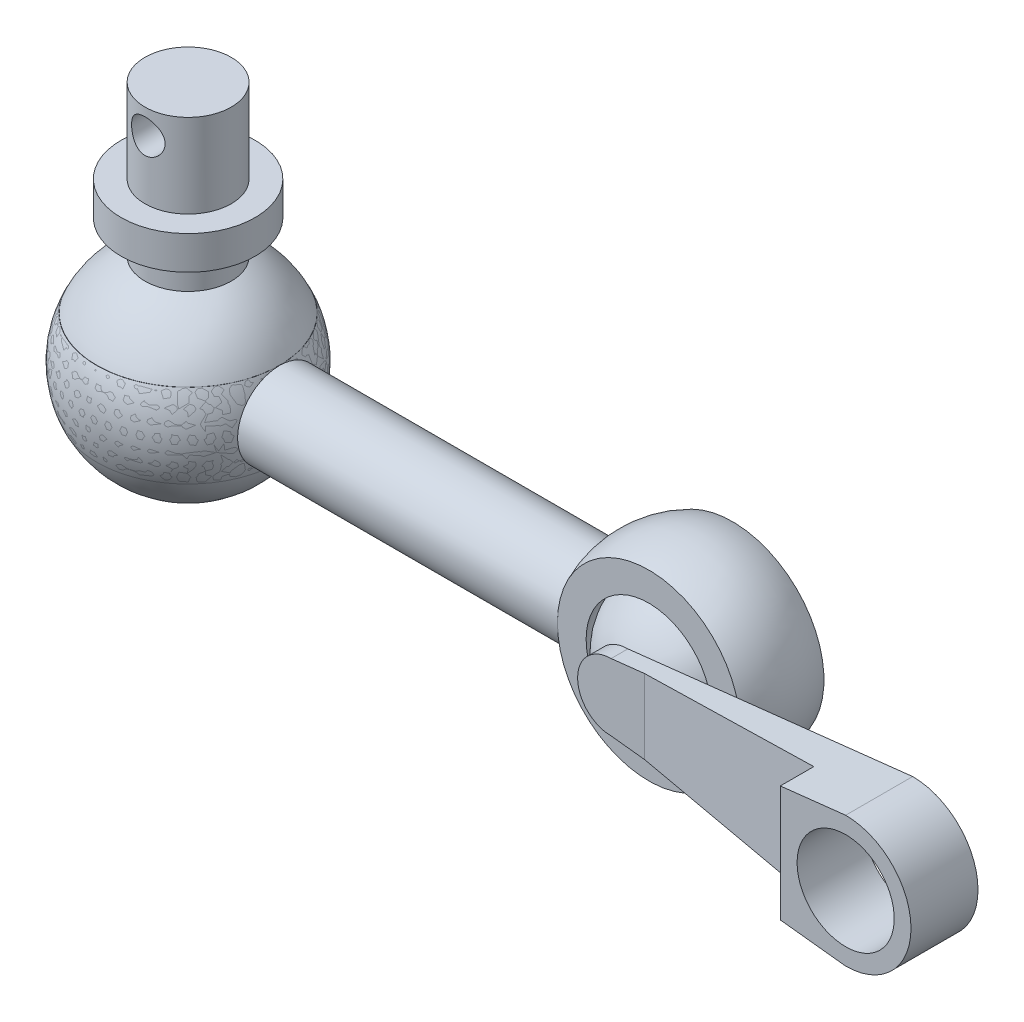
from build123d import *
from build123d.topology import SkipClean

# Parameters (mm, degrees)
BOSS_EXTRUDE1_START     = -4.545644
SKETCH4_R               = 2.5
BOSS_EXTRUDE1_DEPTH     = 19.091288
CUT_EXTRUDE1_DEPTH      = 28.349588662
CUT_EXTRUDE1_DEPTH_BACK = 28.349588662
SKETCH5_W               = 10.908712114
SKETCH5_H               = 5.248275299
CUT_EXTRUDE2_DEPTH      = 28.349588662
CUT_EXTRUDE2_DEPTH_BACK = 28.349588662
SKETCH6_W               = 10.908712114
SKETCH6_H               = 5.959766694
BOSS_EXTRUDE2_START     = 8.75
SKETCH11_R              = 2
BOSS_EXTRUDE2_DEPTH     = 5
BOSS_EXTRUDE3_START     = 14.419352
SKETCH13_R              = 2.575
BOSS_EXTRUDE3_DEPTH     = 9
BOSS_EXTRUDE6_START     = -5
BOSS_EXTRUDE6_DEPTH     = 4
CUT_EXTRUDE3_DEPTH      = 45.241272722
CUT_EXTRUDE3_DEPTH_BACK = 45.241272722
CUT_EXTRUDE4_DEPTH      = 45.449861778
CUT_EXTRUDE4_DEPTH_BACK = 45.449861778
SKETCH19_R              = 2.9
BOSS_EXTRUDE7_START     = -5
SKETCH20_R              = 4
BOSS_EXTRUDE7_DEPTH     = 2
CUT_EXTRUDE6_DEPTH      = 45.054400599
CUT_EXTRUDE6_DEPTH_BACK = 45.054400599
SKETCH21_R              = 1


with BuildPart() as part:
    # Sketch2 → Revolve1 (revolve)
    with BuildSketch(Plane(origin=(0, 0, 0), x_dir=(1, 0, 0), z_dir=(0, 1, 0))):
        with BuildLine():
            Line((20, 6), (20, 4.5))
            ThreePointArc((20, 4.5), (24.5, 0), (20, -4.5))
            Line((20, -4.5), (20, -6))
            ThreePointArc((20, -6), (26, 0), (20, 6))
        make_face()
    revolve(axis=Axis((20, 0, -6), (0, 0, 1)))



with BuildPart() as body_2:
    # Sketch3 → Revolve2 (revolve)
    with BuildSketch(Plane(origin=(0, 0, 0), x_dir=(1, 0, 0), z_dir=(0, 1, 0))):
        with BuildLine():
            Line((-10, 6), (-10, 4.5))
            ThreePointArc((-10, 4.5), (-14.5, 0), (-10, -4.5))
            Line((-10, -4.5), (-10, -6))
            ThreePointArc((-10, -6), (-16, 0), (-10, 6))
        make_face()
    revolve(axis=Axis((-10, 0, -6), (0, 0, 1)))


with BuildPart() as part_1:
    add(part.part)

    add(body_2.part)  # Boss-Extrude1 merges body 2
    # Sketch4 → Boss-Extrude1 (add)
    with BuildSketch(Plane(origin=(0, 0, 0), x_dir=(0, 0, -1), z_dir=(1, 0, 0)).offset(BOSS_EXTRUDE1_START)):
        with Locations(Location((0, 0, 0), (0, 0, 180))):
            Circle(SKETCH4_R)
    extrude(amount=BOSS_EXTRUDE1_DEPTH)

    # Sketch5 → Cut-Extrude1 (cut, two sides: drawn at the far end of the back side and taken through both)
    with SkipClean():  # the faces are left unmerged after this step: merging them gives an invalid solid
        with BuildSketch(Plane.XY.offset(-CUT_EXTRUDE1_DEPTH_BACK)):
            with Locations((-10, 5.124137649)):
                Rectangle(SKETCH5_W, SKETCH5_H)
            with Locations((-10, -5.124137649)):
                Rectangle(SKETCH5_W, SKETCH5_H)
        extrude(amount=CUT_EXTRUDE1_DEPTH + CUT_EXTRUDE1_DEPTH_BACK, mode=Mode.SUBTRACT)

    # Sketch6 → Cut-Extrude2 (cut, two sides: drawn at the far end of the back side and taken through both)
    with SkipClean():  # the faces are left unmerged after this step: merging them gives an invalid solid
        with BuildSketch(Plane(origin=(0, 0, 0), x_dir=(1, 0, 0), z_dir=(0, 1, 0)).offset(-CUT_EXTRUDE2_DEPTH_BACK)):
            with Locations((20, 5.479883347)):
                Rectangle(SKETCH6_W, SKETCH6_H)
            with Locations((20, -5.479883347)):
                Rectangle(SKETCH6_W, SKETCH6_H)
        extrude(amount=CUT_EXTRUDE2_DEPTH + CUT_EXTRUDE2_DEPTH_BACK, mode=Mode.SUBTRACT)


with BuildPart() as body_2_2:
    # Sketch10 → Revolve3 (revolve)
    with BuildSketch(Plane.XY):
        with BuildLine():
            Line((20, 4.25), (20, -4.25))
            ThreePointArc((20, -4.25), (24.25, 0), (20, 4.25))
        make_face()
    revolve(axis=Axis((20, 4.25, 0), (0, -1, 0)))

    # Sketch11 → Boss-Extrude2 (add)
    with BuildSketch(Plane.XY.offset(BOSS_EXTRUDE2_START)):
        with Locations(Location((20, 0, 0), (0, 0, 180))):
            Circle(SKETCH11_R)
    extrude(amount=-BOSS_EXTRUDE2_DEPTH)

    # Sketch16 → Boss-Extrude6 (add)
    with BuildSketch(Plane.XY.offset(8.75).offset(BOSS_EXTRUDE6_START)):
        with BuildLine():
            Line((20, 2), (37, 3.9))
            ThreePointArc((37, 3.9), (40.9, 0), (37, -3.9))
            Line((37, -3.9), (20, -2))
            ThreePointArc((20, -2), (18, 0), (20, 2))
        make_face()
    extrude(amount=BOSS_EXTRUDE6_DEPTH)

    # Sketch18 → Cut-Extrude3 (cut, two sides: drawn at the far end of the back side and taken through both)
    with BuildSketch(Plane(origin=(0, 0, 0), x_dir=(1, 0, 0), z_dir=(0, 1, 0)).offset(-CUT_EXTRUDE3_DEPTH_BACK)):
        Polygon((18, -8.75), (33.1, -8.75), (33.1, -5.75), (22, -4.75), (18, -4.75), align=None)
    extrude(amount=CUT_EXTRUDE3_DEPTH + CUT_EXTRUDE3_DEPTH_BACK, mode=Mode.SUBTRACT)

    # Sketch19 → Cut-Extrude4 (cut, two sides: drawn at the far end of the back side and taken through both)
    with BuildSketch(Plane(origin=(0, 0, 3.75), x_dir=(-1, 0, 0), z_dir=(0, 0, -1)).offset(-CUT_EXTRUDE4_DEPTH_BACK)):
        with Locations((-37, 0)):
            Circle(SKETCH19_R)
    extrude(amount=CUT_EXTRUDE4_DEPTH + CUT_EXTRUDE4_DEPTH_BACK, mode=Mode.SUBTRACT)


with BuildPart() as body_3:
    # Sketch12 → Revolve4 (revolve)
    with BuildSketch(Plane(origin=(0, 0, 0), x_dir=(1, 0, 0), z_dir=(0, 1, 0))):
        with BuildLine():
            Line((-10, 6), (-10, -6))
            ThreePointArc((-10, -6), (-4, 0), (-10, 6))
        make_face()
    revolve(axis=Axis((-10, 0, -6), (0, 0, 1)))

    # Sketch13 → Boss-Extrude3 (add)
    with BuildSketch(Plane(origin=(0, 0, 0), x_dir=(1, 0, 0), z_dir=(0, 1, 0)).offset(BOSS_EXTRUDE3_START)):
        with Locations(Location((-10, 0, 0), (0, 0, 90))):
            Circle(SKETCH13_R)
    extrude(amount=-BOSS_EXTRUDE3_DEPTH)

    # Sketch20 → Boss-Extrude7 (add)
    with BuildSketch(Plane(origin=(0, 14.419351899, 0), x_dir=(1, 0, 0), z_dir=(0, 1, 0)).offset(BOSS_EXTRUDE7_START)):
        with Locations(Location((-10, 0, 0), (0, 0, 270))):
            Circle(SKETCH20_R)
    extrude(amount=-BOSS_EXTRUDE7_DEPTH)

    # Sketch21 → Cut-Extrude6 (cut, two sides: drawn at the far end of the back side and taken through both)
    with BuildSketch(Plane.XY.offset(-CUT_EXTRUDE6_DEPTH_BACK)):
        with Locations((-10, 12.919351899)):
            Circle(SKETCH21_R)
    extrude(amount=CUT_EXTRUDE6_DEPTH + CUT_EXTRUDE6_DEPTH_BACK, mode=Mode.SUBTRACT)


solid = Compound([part_1.part, body_2_2.part, body_3.part])
